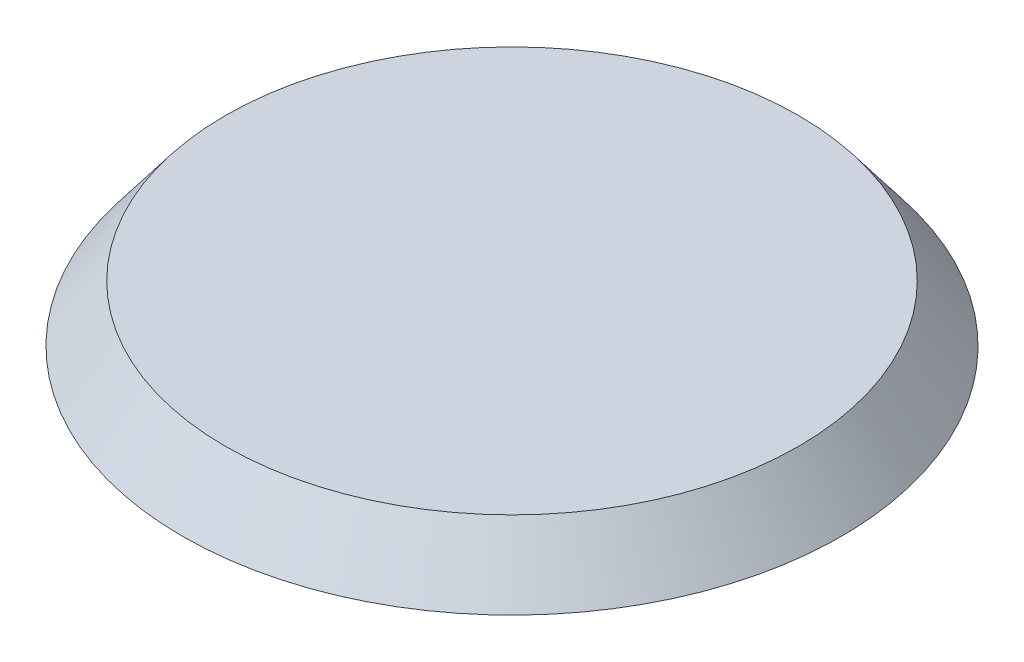
from build123d import *


with BuildPart() as part:
    # Sketch1 → Revolve1 (revolve)
    with BuildSketch(Plane(origin=(0, 0, 0), x_dir=(0, 0, -1), z_dir=(1, 0, 0)), mode=Mode.PRIVATE) as revolve1_sk:
        Polygon((0, 33.54136502), (-25.4, 33.54136502), (-29.21, 28.54136502), (0, 28.54136502), align=None)
    revolve(revolve1_sk.sketch.rotate(Axis((0, 0, 0), (0, 1, 0)), 180), axis=Axis((0, 0, 0), (0, 1, 0)))


solid = part.part
